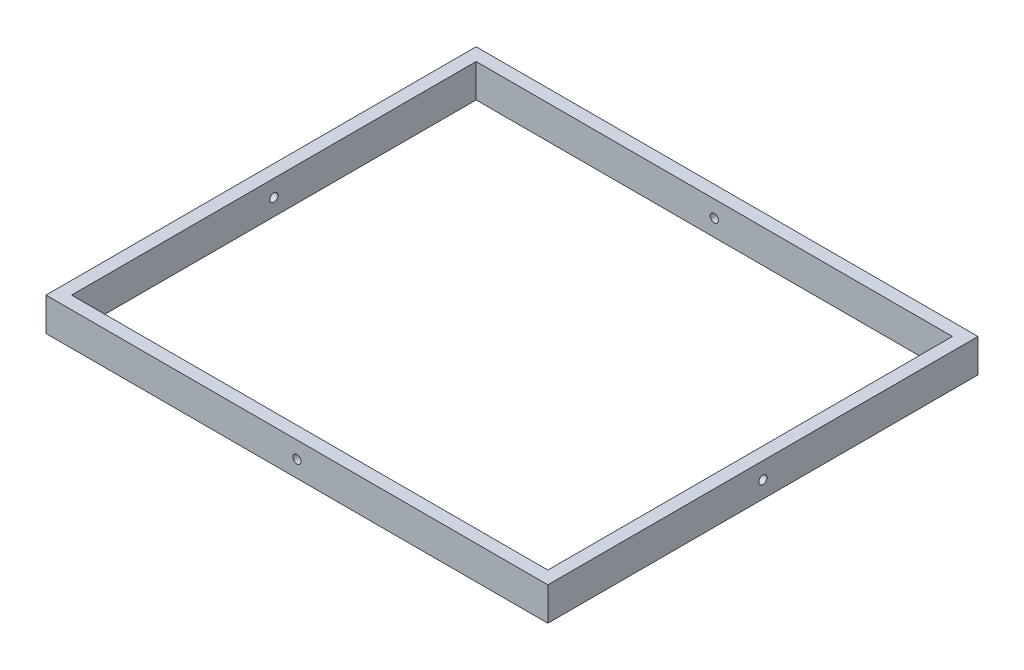
from build123d import *

# Parameters (mm, degrees)
SKETCH1_W           = 311.15
SKETCH1_H           = 266.7
SKETCH1_W_2         = 295.275
SKETCH1_H_2         = 250.825
BOSS_EXTRUDE1_DEPTH = 20.6375
SKETCH2_R           = 2.54
CUT_EXTRUDE1_DEPTH  = 320.049014669
SKETCH3_R           = 2.54
CUT_EXTRUDE2_DEPTH  = 373.362542974


with BuildPart() as part:
    # Sketch1 → Boss-Extrude1 (new body)
    with BuildSketch(Plane(origin=(0, 0, 0), x_dir=(1, 0, 0), z_dir=(0, 1, 0))):
        with Locations((-18.31426751, -70.1534017)):
            Rectangle(SKETCH1_W, SKETCH1_H)
        with Locations((-18.31426751, -70.1534017)):
            Rectangle(SKETCH1_W_2, SKETCH1_H_2, mode=Mode.SUBTRACT)
    extrude(amount=BOSS_EXTRUDE1_DEPTH)

    # Sketch2 → Cut-Extrude1 (cut, through all)
    with BuildSketch(Plane.XY.offset(203.5034017)):
        with Locations((-18.31426751, 10.31875)):
            Circle(SKETCH2_R)
    extrude(amount=-CUT_EXTRUDE1_DEPTH, mode=Mode.SUBTRACT)

    # Sketch3 → Cut-Extrude2 (cut, through all)
    with BuildSketch(Plane(origin=(137.26073249, 0, 0), x_dir=(0, 0, -1), z_dir=(1, 0, 0))):
        with Locations((-70.1534017, 10.31875)):
            Circle(SKETCH3_R)
    extrude(amount=-CUT_EXTRUDE2_DEPTH, mode=Mode.SUBTRACT)


solid = part.part
